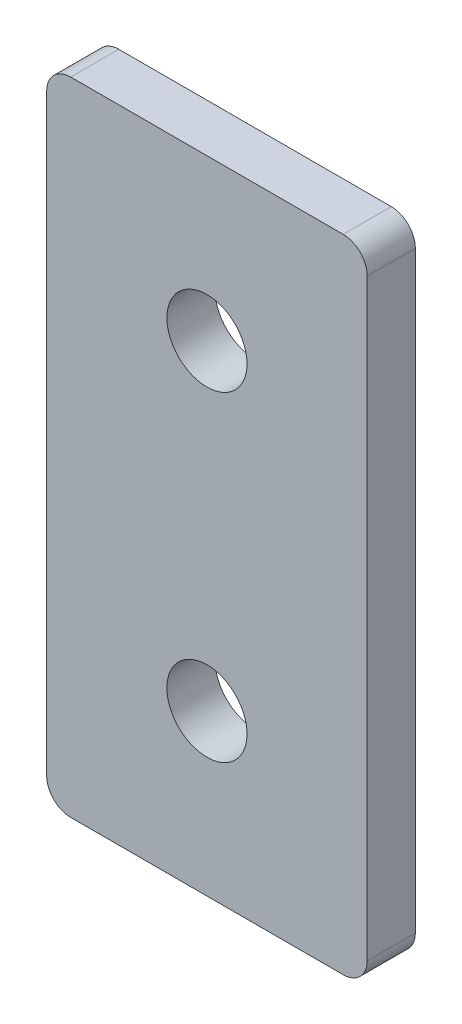
from build123d import *

# Parameters (mm, degrees)
MODEL_R             = 2.5
BOSS_EXTRUDE1_DEPTH = 3


with BuildPart() as part:
    # Model → Boss-Extrude1 (new body)
    with BuildSketch(Plane.XY):
        with BuildLine():
            Line((8.5, 0), (-8.5, 0))
            ThreePointArc((-8.5, 0), (-9.560660172, 0.439339828), (-10, 1.5))
            Line((-10, 1.5), (-10, 38.5))
            ThreePointArc((-10, 38.5), (-9.560660172, 39.560660172), (-8.5, 40))
            Line((-8.5, 40), (8.5, 40))
            ThreePointArc((8.5, 40), (9.560660172, 39.560660172), (10, 38.5))
            Line((10, 38.5), (10, 1.5))
            ThreePointArc((10, 1.5), (9.560660172, 0.439339828), (8.5, 0))
        make_face()
        with Locations((0, 30)):
            Circle(MODEL_R, mode=Mode.SUBTRACT)
        with Locations(Location((0, 10, 0), (0, 0, 180))):
            Circle(MODEL_R, mode=Mode.SUBTRACT)
    extrude(amount=BOSS_EXTRUDE1_DEPTH)


solid = part.part
